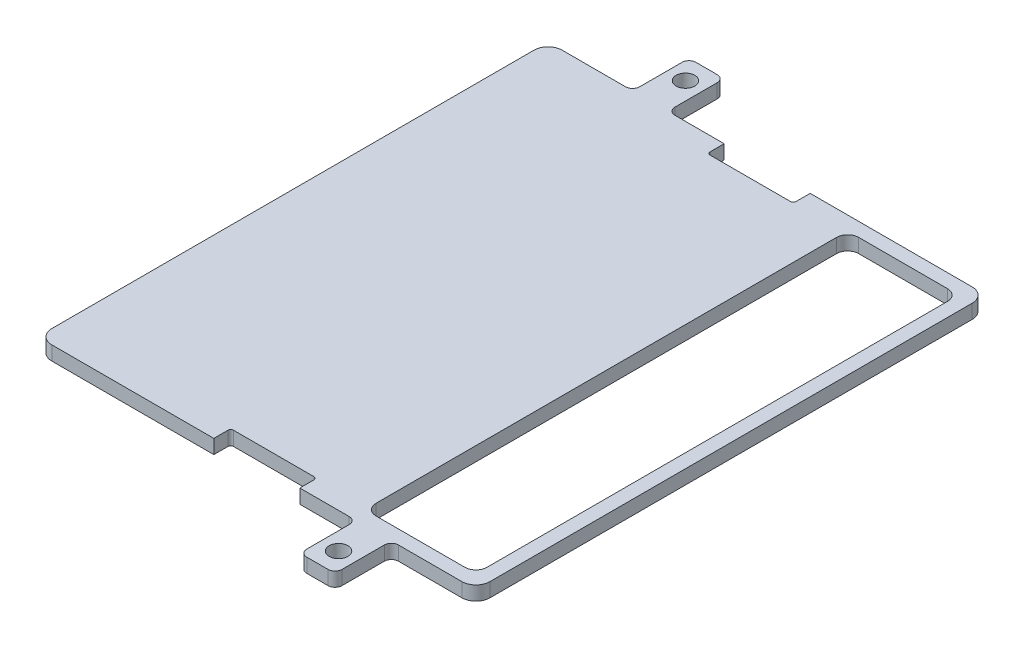
from build123d import *

# Parameters (mm, degrees)
SKETCH1_R           = 1.685173155
BOSS_EXTRUDE2_DEPTH = 2.54
FILLET1_R           = 1.27


with BuildPart() as part:
    # Sketch1 → Boss-Extrude2 (new body)
    with BuildSketch(Plane(origin=(0, 0, 0), x_dir=(1, 0, 0), z_dir=(0, 1, 0))):
        with BuildLine():
            Line((7.25, 42.9514), (-7.25, 42.9514))
            ThreePointArc((-7.25, 42.9514), (-7.603553391, 43.097846609), (-7.75, 43.4514))
            Line((-7.75, 43.4514), (-7.75, 45.9994))
            Line((-7.75, 45.9994), (-17.907, 45.9994))
            Line((-17.907, 45.9994), (-17.907, 54.8894))
            ThreePointArc((-17.907, 54.8894), (-18.278974388, 55.787425612), (-19.177, 56.1594))
            Line((-19.177, 56.1594), (-22.987, 56.1594))
            ThreePointArc((-22.987, 56.1594), (-23.885025612, 55.787425612), (-24.257, 54.8894))
            Line((-24.257, 54.8894), (-24.257, 45.9994))
            Line((-24.257, 45.9994), (-36.957, 45.9994))
            ThreePointArc((-36.957, 45.9994), (-38.753051224, 45.255451224), (-39.497, 43.4594))
            Line((-39.497, 43.4594), (-39.497, -43.4594))
            ThreePointArc((-39.497, -43.4594), (-38.753051224, -45.255451224), (-36.957, -45.9994))
            Line((-36.957, -45.9994), (-7.75, -45.9994))
            Line((-7.75, -45.9994), (-7.75, -43.4514))
            ThreePointArc((-7.75, -43.4514), (-7.603553391, -43.097846609), (-7.25, -42.9514))
            Line((-7.25, -42.9514), (7.25, -42.9514))
            ThreePointArc((7.25, -42.9514), (7.603553391, -43.097846609), (7.75, -43.4514))
            Line((7.75, -43.4514), (7.75, -45.9994))
            Line((7.75, -45.9994), (17.907, -45.9994))
            Line((17.907, -45.9994), (17.907, -54.8894))
            ThreePointArc((17.907, -54.8894), (18.278974388, -55.787425612), (19.177, -56.1594))
            Line((19.177, -56.1594), (22.987, -56.1594))
            ThreePointArc((22.987, -56.1594), (23.885025612, -55.787425612), (24.257, -54.8894))
            Line((24.257, -54.8894), (24.257, -45.9994))
            Line((24.257, -45.9994), (36.957, -45.9994))
            ThreePointArc((36.957, -45.9994), (38.753051224, -45.255451224), (39.497, -43.4594))
            Line((39.497, -43.4594), (39.497, 43.4594))
            ThreePointArc((39.497, 43.4594), (38.753051224, 45.255451224), (36.957, 45.9994))
            Line((36.957, 45.9994), (7.75, 45.9994))
            Line((7.75, 45.9994), (7.75, 43.4514))
            ThreePointArc((7.75, 43.4514), (7.603553391, 43.097846609), (7.25, 42.9514))
        make_face()
        with BuildLine():
            ThreePointArc((16.997, 41.4994), (17.582786438, 42.913613562), (18.997, 43.4994))
            Line((18.997, 43.4994), (34.997, 43.4994))
            ThreePointArc((34.997, 43.4994), (36.411213562, 42.913613562), (36.997, 41.4994))
            Line((36.997, 41.4994), (36.997, -41.4994))
            ThreePointArc((36.997, -41.4994), (36.411213562, -42.913613562), (34.997, -43.4994))
            Line((34.997, -43.4994), (18.997, -43.4994))
            ThreePointArc((18.997, -43.4994), (17.582786438, -42.913613562), (16.997, -41.4994))
            Line((16.997, -41.4994), (16.997, 41.4994))
        make_face(mode=Mode.SUBTRACT)
        with Locations(Location((-21.082, 52.3494, 0), (0, 0, 270))):
            Circle(SKETCH1_R, mode=Mode.SUBTRACT)
        with Locations(Location((21.082, -52.3494, 0), (0, 0, 270))):
            Circle(SKETCH1_R, mode=Mode.SUBTRACT)
    extrude(amount=BOSS_EXTRUDE2_DEPTH)

    # Fillet1
    fillet1_edges = [part.edges().sort_by_distance(p)[0] for p in [
        (-24.257, 1.27, -45.9994),
        (-17.907, 1.27, -45.9994),
        (24.257, 1.27, 45.9994),
        (17.907, 1.27, 45.9994),
    ]]
    fillet(fillet1_edges, radius=FILLET1_R)


solid = part.part
